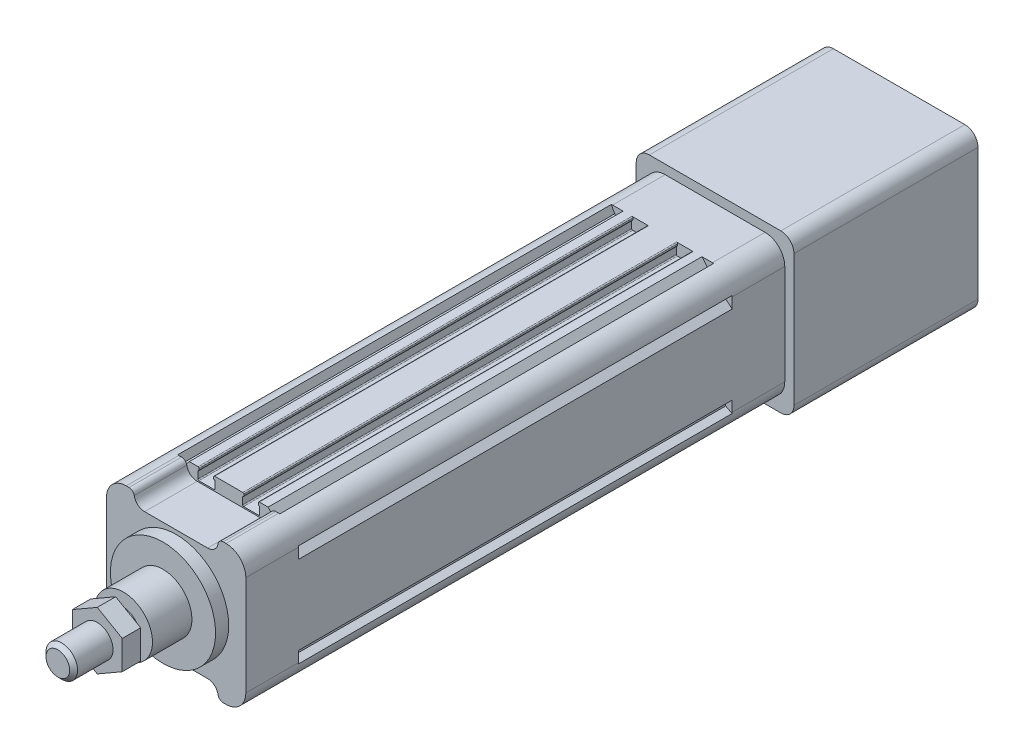
from build123d import *

# Parameters (mm, degrees)
SKETCH_1_R             = 2.1
EXTRUDE_1_DEPTH        = 165
EXTRUDE_2_DEPTH        = 20
SKETCH_7_R             = 20
EXTRUDE_3_DEPTH        = 5
SKETCH_9_R             = 11
EXTRUDE_4_DEPTH        = 15
SKETCH_10_R            = 6
EXTRUDE_5_DEPTH        = 25
EXTRUDE_START          = 20
EXTRUDE_6_DEPTH        = 20
EXTRUDE_7_DEPTH        = 70
SKETCH_14_R            = 19
CUT_EXTRUDE_2_DEPTH    = 70
HOLE_WIZARD_M6_1_D     = 5
HOLE_WIZARD_M6_1_DEPTH = 15
HOLE_WIZARD_M6_1_TIP   = 1.502151548
CHAMFER_1_SIZE         = 1.5
EXTRUDE_START_2        = 3
EXTRUDE_8_DEPTH        = 7


with BuildPart() as part:
    # 草图1 → 凸台-拉伸1 (new body)
    with BuildSketch(Plane.XY):
        with BuildLine():
            Line((-18.2, 24), (-19.443439638, 26.486879276))
            ThreePointArc((-19.443439638, 26.486879276), (-24.303300859, 24.303300859), (-26.486879276, 19.443439638))
            Line((-26.486879276, 19.443439638), (-24, 18.2))
            Line((-24, 18.2), (-24, 17.1))
            Line((-24, 17.1), (-26.5, 15))
            Line((-26.5, 15), (-26.5, -15))
            Line((-26.5, -15), (-24, -17.1))
            Line((-24, -17.1), (-24, -18.2))
            Line((-24, -18.2), (-26.486879276, -19.443439638))
            ThreePointArc((-26.486879276, -19.443439638), (-24.303300859, -24.303300859), (-19.443439638, -26.486879276))
            Line((-19.443439638, -26.486879276), (-18.2, -24))
            Line((-18.2, -24), (-17.1, -24))
            Line((-17.1, -24), (-15, -26.5))
            Line((-15, -26.5), (-11.65, -26.5))
            ThreePointArc((-11.65, -26.5), (-11.367157288, -26.382842712), (-11.25, -26.1))
            Line((-11.25, -26.1), (-11.25, -25.6))
            ThreePointArc((-11.25, -25.6), (-11.367157288, -25.317157288), (-11.65, -25.2))
            Line((-11.65, -25.2), (-11.75, -25.2))
            Line((-11.75, -25.2), (-11.75, -22.4))
            ThreePointArc((-11.75, -22.4), (-11.632842712, -22.117157288), (-11.35, -22))
            Line((-11.35, -22), (-5.65, -22))
            ThreePointArc((-5.65, -22), (-5.367157288, -22.117157288), (-5.25, -22.4))
            Line((-5.25, -22.4), (-5.25, -25.2))
            Line((-5.25, -25.2), (-5.35, -25.2))
            ThreePointArc((-5.35, -25.2), (-5.632842712, -25.317157288), (-5.75, -25.6))
            Line((-5.75, -25.6), (-5.75, -26.1))
            ThreePointArc((-5.75, -26.1), (-5.632842712, -26.382842712), (-5.35, -26.5))
            Line((-5.35, -26.5), (5.35, -26.5))
            ThreePointArc((5.35, -26.5), (5.632842712, -26.382842712), (5.75, -26.1))
            Line((5.75, -26.1), (5.75, -25.6))
            ThreePointArc((5.75, -25.6), (5.632842712, -25.317157288), (5.35, -25.2))
            Line((5.35, -25.2), (5.25, -25.2))
            Line((5.25, -25.2), (5.25, -22.4))
            ThreePointArc((5.25, -22.4), (5.367157288, -22.117157288), (5.65, -22))
            Line((5.65, -22), (11.35, -22))
            ThreePointArc((11.35, -22), (11.632842712, -22.117157288), (11.75, -22.4))
            Line((11.75, -22.4), (11.75, -25.2))
            Line((11.75, -25.2), (11.65, -25.2))
            ThreePointArc((11.65, -25.2), (11.367157288, -25.317157288), (11.25, -25.6))
            Line((11.25, -25.6), (11.25, -26.1))
            ThreePointArc((11.25, -26.1), (11.367157288, -26.382842712), (11.65, -26.5))
            Line((11.65, -26.5), (15, -26.5))
            Line((15, -26.5), (17.1, -24))
            Line((17.1, -24), (18.2, -24))
            Line((18.2, -24), (19.443439638, -26.486879276))
            ThreePointArc((19.443439638, -26.486879276), (24.303300859, -24.303300859), (26.486879276, -19.443439638))
            Line((26.486879276, -19.443439638), (24, -18.2))
            Line((24, -18.2), (24, -17.1))
            Line((24, -17.1), (26.5, -15))
            Line((26.5, -15), (26.5, 15))
            Line((26.5, 15), (24, 17.1))
            Line((24, 17.1), (24, 18.2))
            Line((24, 18.2), (26.486879276, 19.443439638))
            ThreePointArc((26.486879276, 19.443439638), (24.303300859, 24.303300859), (19.443439638, 26.486879276))
            Line((19.443439638, 26.486879276), (18.2, 24))
            Line((18.2, 24), (17.1, 24))
            Line((17.1, 24), (15, 26.5))
            Line((15, 26.5), (11.65, 26.5))
            ThreePointArc((11.65, 26.5), (11.367157288, 26.382842712), (11.25, 26.1))
            Line((11.25, 26.1), (11.25, 25.6))
            ThreePointArc((11.25, 25.6), (11.367157288, 25.317157288), (11.65, 25.2))
            Line((11.65, 25.2), (11.75, 25.2))
            Line((11.75, 25.2), (11.75, 22.4))
            ThreePointArc((11.75, 22.4), (11.632842712, 22.117157288), (11.35, 22))
            Line((11.35, 22), (5.65, 22))
            ThreePointArc((5.65, 22), (5.367157288, 22.117157288), (5.25, 22.4))
            Line((5.25, 22.4), (5.25, 25.2))
            Line((5.25, 25.2), (5.35, 25.2))
            ThreePointArc((5.35, 25.2), (5.632842712, 25.317157288), (5.75, 25.6))
            Line((5.75, 25.6), (5.75, 26.1))
            ThreePointArc((5.75, 26.1), (5.632842712, 26.382842712), (5.35, 26.5))
            Line((5.35, 26.5), (-5.35, 26.5))
            ThreePointArc((-5.35, 26.5), (-5.632842712, 26.382842712), (-5.75, 26.1))
            Line((-5.75, 26.1), (-5.75, 25.6))
            ThreePointArc((-5.75, 25.6), (-5.632842712, 25.317157288), (-5.35, 25.2))
            Line((-5.35, 25.2), (-5.25, 25.2))
            Line((-5.25, 25.2), (-5.25, 22.4))
            ThreePointArc((-5.25, 22.4), (-5.367157288, 22.117157288), (-5.65, 22))
            Line((-5.65, 22), (-11.35, 22))
            ThreePointArc((-11.35, 22), (-11.632842712, 22.117157288), (-11.75, 22.4))
            Line((-11.75, 22.4), (-11.75, 25.2))
            Line((-11.75, 25.2), (-11.65, 25.2))
            ThreePointArc((-11.65, 25.2), (-11.367157288, 25.317157288), (-11.25, 25.6))
            Line((-11.25, 25.6), (-11.25, 26.1))
            ThreePointArc((-11.25, 26.1), (-11.367157288, 26.382842712), (-11.65, 26.5))
            Line((-11.65, 26.5), (-15, 26.5))
            Line((-15, 26.5), (-17.1, 24))
            Line((-17.1, 24), (-18.2, 24))
        make_face()
        with Locations((19, 19)):
            Circle(SKETCH_1_R, mode=Mode.SUBTRACT)
        with Locations((19, -19)):
            Circle(SKETCH_1_R, mode=Mode.SUBTRACT)
        with Locations((-19, -19)):
            Circle(SKETCH_1_R, mode=Mode.SUBTRACT)
        with Locations((-19, 19)):
            Circle(SKETCH_1_R, mode=Mode.SUBTRACT)
        with BuildLine():
            Line((19.773719933, 3), (23.3, 3))
            Line((23.3, 3), (23.3, -3))
            Line((23.3, -3), (19.773719933, -3))
            ThreePointArc((19.773719933, -3), (0, -20), (-19.773719933, -3))
            Line((-19.773719933, -3), (-23.3, -3))
            Line((-23.3, -3), (-23.3, 3))
            Line((-23.3, 3), (-19.773719933, 3))
            ThreePointArc((-19.773719933, 3), (0, 20), (19.773719933, 3))
        make_face(mode=Mode.SUBTRACT)
    extrude(amount=EXTRUDE_1_DEPTH)

    # 草图6 → 凸台-拉伸2 (add)
    with BuildSketch(Plane.XY.offset(165)):
        with BuildLine():
            Line((-26.5, -19), (-26.5, 19))
            ThreePointArc((-26.5, 19), (-24.303300859, 24.303300859), (-19, 26.5))
            Line((-19, 26.5), (-17.916079783, 26.5))
            ThreePointArc((-17.916079783, 26.5), (-16.625085334, 26.027525232), (-15.944053189, 24.833333333))
            ThreePointArc((-15.944053189, 24.833333333), (-14.581988897, 22.444949537), (-12, 21.5))
            Line((-12, 21.5), (12, 21.5))
            ThreePointArc((12, 21.5), (14.581988897, 22.444949537), (15.944053189, 24.833333333))
            ThreePointArc((15.944053189, 24.833333333), (16.625085334, 26.027525232), (17.916079783, 26.5))
            Line((17.916079783, 26.5), (19, 26.5))
            ThreePointArc((19, 26.5), (24.303300859, 24.303300859), (26.5, 19))
            Line((26.5, 19), (26.5, -19))
            ThreePointArc((26.5, -19), (24.303300859, -24.303300859), (19, -26.5))
            Line((19, -26.5), (17.916079783, -26.5))
            ThreePointArc((17.916079783, -26.5), (16.625085334, -26.027525232), (15.944053189, -24.833333333))
            ThreePointArc((15.944053189, -24.833333333), (14.581988897, -22.444949537), (12, -21.5))
            Line((12, -21.5), (-12, -21.5))
            ThreePointArc((-12, -21.5), (-14.581988897, -22.444949537), (-15.944053189, -24.833333333))
            ThreePointArc((-15.944053189, -24.833333333), (-16.625085334, -26.027525232), (-17.916079783, -26.5))
            Line((-17.916079783, -26.5), (-19, -26.5))
            ThreePointArc((-19, -26.5), (-24.303300859, -24.303300859), (-26.5, -19))
        make_face()
    extrude(amount=EXTRUDE_2_DEPTH)

    # 草图7 → 凸台-拉伸3 (add)
    with BuildSketch(Plane.XY.offset(185)):
        Circle(SKETCH_7_R)
    extrude(amount=EXTRUDE_3_DEPTH)

    # 草图9 → 凸台-拉伸4 (add)
    with BuildSketch(Plane.XY.offset(190)):
        Circle(SKETCH_9_R)
    extrude(amount=EXTRUDE_4_DEPTH)

    # 草图10 → 凸台-拉伸5 (add)
    with BuildSketch(Plane.XY.offset(205)):
        Circle(SKETCH_10_R)
    extrude(amount=EXTRUDE_5_DEPTH)

    # 草图11 → 凸台-拉伸6 (add)
    with BuildSketch(Plane(origin=(0, 0, 0), x_dir=(-1, 0, 0), z_dir=(0, 0, -1)).offset(EXTRUDE_START)):
        with BuildLine():
            Line((-19, -26.5), (19, -26.5))
            ThreePointArc((19, -26.5), (24.303300859, -24.303300859), (26.5, -19))
            Line((26.5, -19), (26.5, 19))
            ThreePointArc((26.5, 19), (24.303300859, 24.303300859), (19, 26.5))
            Line((19, 26.5), (-19, 26.5))
            ThreePointArc((-19, 26.5), (-24.303300859, 24.303300859), (-26.5, 19))
            Line((-26.5, 19), (-26.5, -19))
            ThreePointArc((-26.5, -19), (-24.303300859, -24.303300859), (-19, -26.5))
        make_face()
    extrude(amount=-EXTRUDE_6_DEPTH)

    # 草图12 → 凸台-拉伸7 (add)
    with BuildSketch(Plane(origin=(0, 0, -20), x_dir=(-1, 0, 0), z_dir=(0, 0, -1))):
        with BuildLine():
            Line((-25, -30), (25, -30))
            ThreePointArc((25, -30), (28.535533906, -28.535533906), (30, -25))
            Line((30, -25), (30, 25))
            ThreePointArc((30, 25), (28.535533906, 28.535533906), (25, 30))
            Line((25, 30), (-25, 30))
            ThreePointArc((-25, 30), (-28.535533906, 28.535533906), (-30, 25))
            Line((-30, 25), (-30, -25))
            ThreePointArc((-30, -25), (-28.535533906, -28.535533906), (-25, -30))
        make_face()
    extrude(amount=EXTRUDE_7_DEPTH)

    # 草图14 → 切除-拉伸2 (cut)
    with BuildSketch(Plane(origin=(0, 0, -90), x_dir=(-1, 0, 0), z_dir=(0, 0, -1))):
        Circle(SKETCH_14_R)
    extrude(amount=-CUT_EXTRUDE_2_DEPTH, mode=Mode.SUBTRACT)

    # M6 螺纹孔1
    with Locations(Plane.ZY.offset(26.5)):
        with Locations((175, 11), (175, -11), (-10, 11), (-10, -11)):
            Hole(HOLE_WIZARD_M6_1_D / 2, depth=HOLE_WIZARD_M6_1_DEPTH)
            with Locations((0, 0, -(HOLE_WIZARD_M6_1_DEPTH + HOLE_WIZARD_M6_1_TIP / 2))):  # 118° drill point
                Cone(0, HOLE_WIZARD_M6_1_D / 2, HOLE_WIZARD_M6_1_TIP, mode=Mode.SUBTRACT)

    # 倒角1
    chamfer_1_edges = [part.edges().sort_by_distance(p)[0] for p in [
        (-6, 0, 230),
    ]]
    chamfer(chamfer_1_edges, length=CHAMFER_1_SIZE)

    # 草图17 → 凸台-拉伸8 (add)
    with BuildSketch(Plane.XY.offset(205).offset(EXTRUDE_START_2)):
        Polygon((0, 10.969655115), (-9.5, 5.484827557), (-9.5, -5.484827557), (0, -10.969655115), (9.5, -5.484827557), (9.5, 5.484827557), align=None)
    extrude(amount=EXTRUDE_8_DEPTH)


solid = part.part
